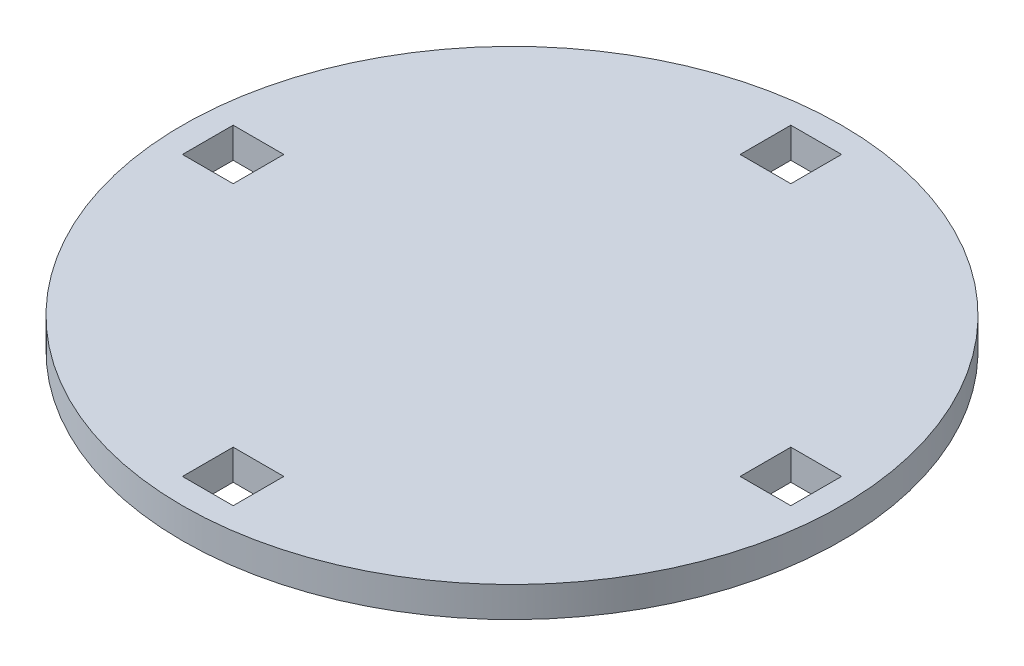
from build123d import *

# Parameters (mm, degrees)
SKETCH1_R               = 32.5
BOSS_EXTRUDE1_DEPTH     = 3
CUT_EXTRUDE1_DEPTH      = 10
CUT_EXTRUDE1_DEPTH_BACK = 47.059743812
SKETCH2_W               = 5
SKETCH2_H               = 5


with BuildPart() as part:
    # Sketch1 → Boss-Extrude1 (new body)
    with BuildSketch(Plane(origin=(0, 0, 0), x_dir=(1, 0, 0), z_dir=(0, 1, 0))):
        with Locations(Location((0, 0, 0), (0, 0, 270))):
            Circle(SKETCH1_R)
    extrude(amount=BOSS_EXTRUDE1_DEPTH)

    # Sketch2 → Cut-Extrude1 (cut, two sides: drawn at the far end of the back side and taken through both)
    with BuildSketch(Plane(origin=(0, 0, 0), x_dir=(1, 0, 0), z_dir=(0, 1, 0)).offset(-CUT_EXTRUDE1_DEPTH_BACK)):
        with Locations((0, -27.5)):
            Rectangle(SKETCH2_W, SKETCH2_H)
        with Locations((27.5, 0)):
            Rectangle(SKETCH2_W, SKETCH2_H)
        with Locations((-27.5, 0)):
            Rectangle(SKETCH2_W, SKETCH2_H)
        with Locations((0, 27.5)):
            Rectangle(SKETCH2_W, SKETCH2_H)
    extrude(amount=CUT_EXTRUDE1_DEPTH + CUT_EXTRUDE1_DEPTH_BACK, mode=Mode.SUBTRACT)


solid = part.part
